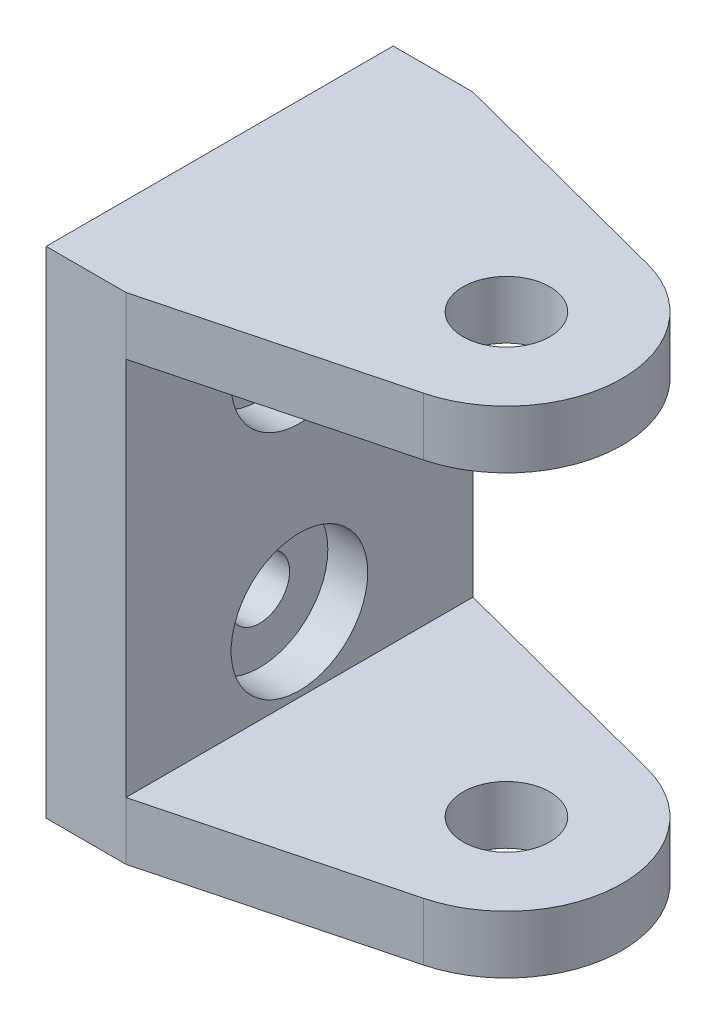
from build123d import *

# Parameters (mm, degrees)
SKETCH1_W                               = 8.76
SKETCH1_H                               = 38.1
BOSS_EXTRUDE1_DEPTH                     = 54.37886
CBORE_FOR_M6_HEX_HEAD_BOLT1_D           = 6.6
CBORE_FOR_M6_HEX_HEAD_BOLT1_DEPTH       = 14.019159957
CBORE_FOR_M6_HEX_HEAD_BOLT1_CBORE_D     = 15
CBORE_FOR_M6_HEX_HEAD_BOLT1_CBORE_DEPTH = 4.38
CBORE_FOR_M6_HEX_HEAD_BOLT1_TIP         = 1.982840043
SKETCH6_R                               = 4.7625
BOSS_EXTRUDE2_DEPTH                     = 6.35


with BuildPart() as part:
    # Sketch1 → Boss-Extrude1 (new body)
    with BuildSketch(Plane(origin=(0, 0, 0), x_dir=(1, 0, 0), z_dir=(0, 1, 0))):
        with Locations((20.010864679, -46.77095316)):
            Rectangle(SKETCH1_W, SKETCH1_H)
    extrude(amount=BOSS_EXTRUDE1_DEPTH)

    # CBORE for M6 Hex Head Bolt1
    with Locations(Plane(origin=(24.390864679, 0, 0), x_dir=(0, 0, -1), z_dir=(1, 0, 0))):
        with Locations((-46.77095316, 14.48943), (-46.77095316, 39.88943)):
            CounterBoreHole(CBORE_FOR_M6_HEX_HEAD_BOLT1_D / 2, CBORE_FOR_M6_HEX_HEAD_BOLT1_CBORE_D / 2, CBORE_FOR_M6_HEX_HEAD_BOLT1_CBORE_DEPTH, depth=CBORE_FOR_M6_HEX_HEAD_BOLT1_DEPTH)
            with Locations((0, 0, -(CBORE_FOR_M6_HEX_HEAD_BOLT1_DEPTH + CBORE_FOR_M6_HEX_HEAD_BOLT1_TIP / 2))):  # 118° drill point
                Cone(0, CBORE_FOR_M6_HEX_HEAD_BOLT1_D / 2, CBORE_FOR_M6_HEX_HEAD_BOLT1_TIP, mode=Mode.SUBTRACT)

    # Sketch6 → Boss-Extrude2 (add)
    with BuildSketch(Plane(origin=(0, 54.37886, 0), x_dir=(1, 0, 0), z_dir=(0, 1, 0))):
        with BuildLine():
            Line((24.390864679, -27.72095316), (24.390864679, -65.82095316))
            Line((24.390864679, -65.82095316), (50.322824333, -59.060163405))
            ThreePointArc((50.322824333, -59.060163405), (59.818871843, -46.77095316), (50.322824333, -34.481742916))
            Line((50.322824333, -34.481742916), (24.390864679, -27.72095316))
        make_face()
        with Locations(Location((47.118871843, -46.77095316, 0), (0, 0, 270))):
            Circle(SKETCH6_R, mode=Mode.SUBTRACT)
    boss_extrude2 = extrude(amount=-BOSS_EXTRUDE2_DEPTH)

    # Mirror1: Boss-Extrude2 across plane
    add(boss_extrude2.mirror(Plane.ZX.offset(27.18943)))


solid = part.part
